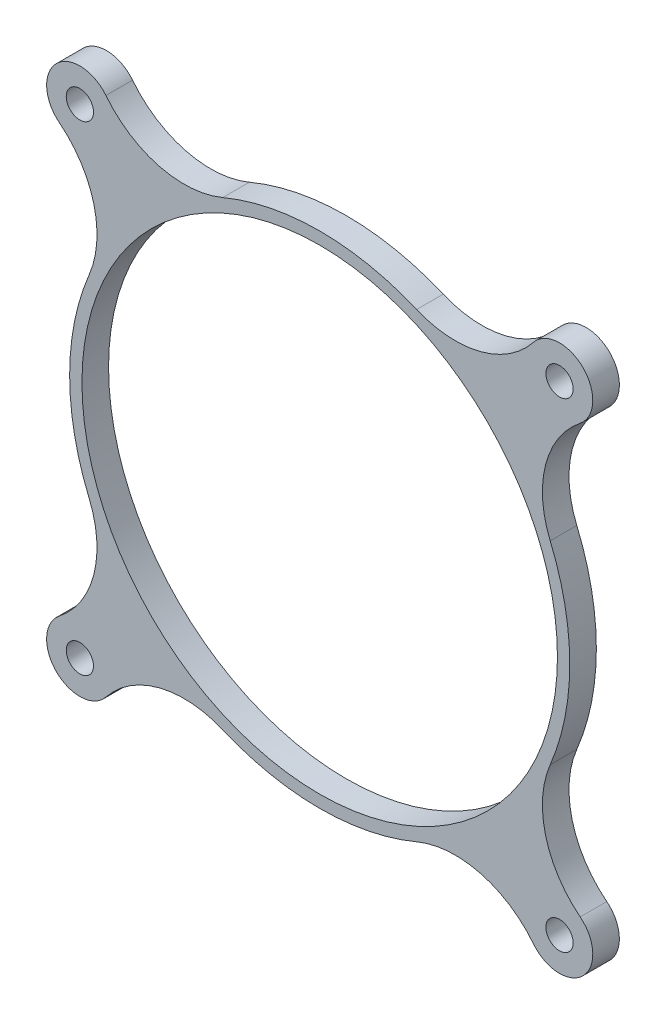
from build123d import *

# Parameters (mm, degrees)
SKETCH2_R           = 34
SKETCH2_R_2         = 2.05
BOSS_EXTRUDE1_DEPTH = 4
CUT_EXTRUDE1_START  = -6
SKETCH3_R           = 35.75
SKETCH3_R_2         = 34
CUT_EXTRUDE1_DEPTH  = 10


with BuildPart() as part:
    # Sketch2 → Boss-Extrude1 (new body)
    with BuildSketch(Plane(origin=(0, 0, 0), x_dir=(0, 1, 0), z_dir=(0, 0, 1))):
        with BuildLine():
            ThreePointArc((-32.144333809, 39.168632909), (-39.597979746, 39.597979746), (-39.168632909, 32.144333809))
            ThreePointArc((-39.168632909, 32.144333809), (-33.957976607, 24.118514652), (-34.660047505, 14.575359582))
            ThreePointArc((-34.660047505, 14.575359582), (-37.6, 0), (-34.660047505, -14.575359582))
            ThreePointArc((-34.660047505, -14.575359582), (-33.957976607, -24.118514652), (-39.168632909, -32.144333809))
            ThreePointArc((-39.168632909, -32.144333809), (-39.597979746, -39.597979746), (-32.144333809, -39.168632909))
            ThreePointArc((-32.144333809, -39.168632909), (-24.118514652, -33.957976607), (-14.575359582, -34.660047505))
            ThreePointArc((-14.575359582, -34.660047505), (0, -37.6), (14.575359582, -34.660047505))
            ThreePointArc((14.575359582, -34.660047505), (24.118514652, -33.957976607), (32.144333809, -39.168632909))
            ThreePointArc((32.144333809, -39.168632909), (39.597979746, -39.597979746), (39.168632909, -32.144333809))
            ThreePointArc((39.168632909, -32.144333809), (33.957976607, -24.118514652), (34.660047505, -14.575359582))
            ThreePointArc((34.660047505, -14.575359582), (37.6, 0), (34.660047505, 14.575359582))
            ThreePointArc((34.660047505, 14.575359582), (33.957976607, 24.118514652), (39.168632909, 32.144333809))
            ThreePointArc((39.168632909, 32.144333809), (39.597979746, 39.597979746), (32.144333809, 39.168632909))
            ThreePointArc((32.144333809, 39.168632909), (24.118514652, 33.957976607), (14.575359582, 34.660047505))
            ThreePointArc((14.575359582, 34.660047505), (0, 37.6), (-14.575359582, 34.660047505))
            ThreePointArc((-14.575359582, 34.660047505), (-24.118514652, 33.957976607), (-32.144333809, 39.168632909))
        make_face()
        with Locations(Location((0, 0, 0), (0, 0, 270))):
            Circle(SKETCH2_R, mode=Mode.SUBTRACT)
        with Locations(Location((-36.062445841, 36.062445841, 0), (0, 0, 270))):
            Circle(SKETCH2_R_2, mode=Mode.SUBTRACT)
        with Locations(Location((36.062445841, 36.062445841, 0), (0, 0, 90))):
            Circle(SKETCH2_R_2, mode=Mode.SUBTRACT)
        with Locations(Location((36.062445841, -36.062445841, 0), (0, 0, 270))):
            Circle(SKETCH2_R_2, mode=Mode.SUBTRACT)
        with Locations(Location((-36.062445841, -36.062445841, 0), (0, 0, 90))):
            Circle(SKETCH2_R_2, mode=Mode.SUBTRACT)
    extrude(amount=BOSS_EXTRUDE1_DEPTH)

    # Sketch3 → Cut-Extrude1 (cut)
    with BuildSketch(Plane(origin=(0, 0, 0), x_dir=(0, 1, 0), z_dir=(0, 0, 1)).offset(CUT_EXTRUDE1_START)):
        with Locations(Location((0, 0, 0), (0, 0, 90))):
            Circle(SKETCH3_R)
        Circle(SKETCH3_R_2, mode=Mode.SUBTRACT)
    extrude(amount=CUT_EXTRUDE1_DEPTH, mode=Mode.SUBTRACT)


solid = part.part
